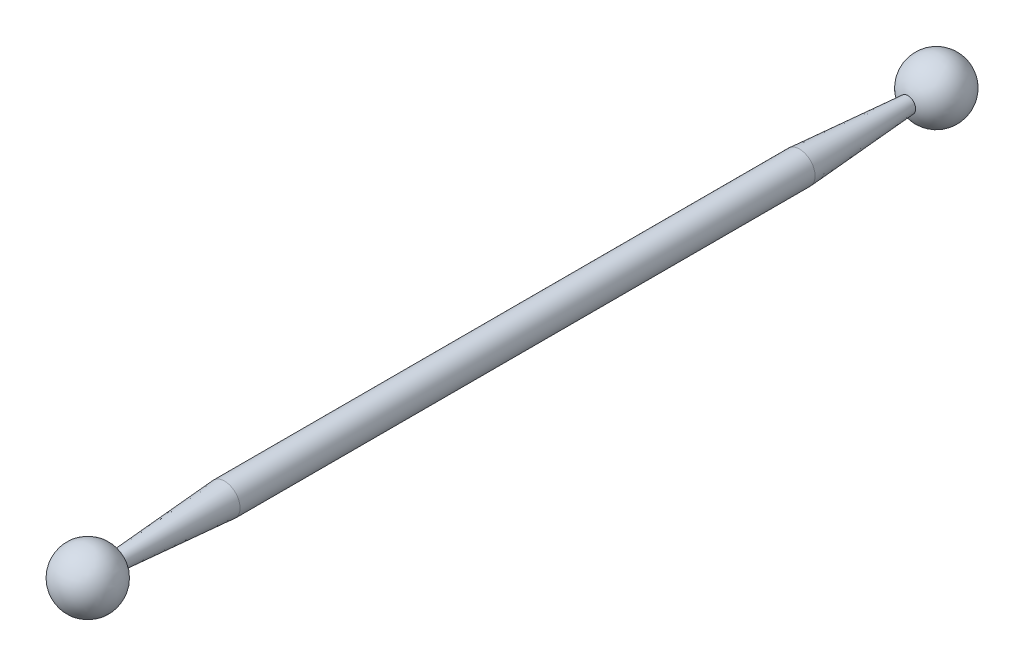
from build123d import *

# Parameters (mm, degrees)
SKETCH2_R           = 5
SKETCH3_R           = 2.5
SKETCH4_R           = 5
BOSS_EXTRUDE2_DEPTH = 185
SKETCH5_R           = 5
SKETCH6_R           = 2.5


with BuildPart() as part:
    # Sketch2 → Loft1 section 0
    with BuildSketch(Plane.XY):
        Circle(SKETCH2_R)
    # Sketch3 → Loft1 section 1
    with BuildSketch(Plane.XY.offset(35)):
        Circle(SKETCH3_R)
    loft()

    # Sketch4 → Boss-Extrude2 (add)
    with BuildSketch(Plane(origin=(0, 0, 0), x_dir=(-1, 0, 0), z_dir=(0, 0, -1))):
        Circle(SKETCH4_R)
    extrude(amount=BOSS_EXTRUDE2_DEPTH)

    # Sketch5 → Loft2 section 0
    with BuildSketch(Plane(origin=(0, 0, -185), x_dir=(-1, 0, 0), z_dir=(0, 0, -1))):
        Circle(SKETCH5_R)
    # Sketch6 → Loft2 section 1
    with BuildSketch(Plane(origin=(0, 0, -220), x_dir=(-1, 0, 0), z_dir=(0, 0, -1))):
        Circle(SKETCH6_R)
    loft()

    # Sketch9 → Revolve2 (revolve)
    with BuildSketch(Plane(origin=(0, 0, -229), x_dir=(-1, 0, 0), z_dir=(0, 0, -1))):
        with BuildLine():
            Line((0, 9.5), (0, -9.5))
            ThreePointArc((0, -9.5), (9.5, 0), (0, 9.5))
        make_face()
    revolve(axis=Axis((0, 9.5, -229), (0, -1, 0)))


with BuildPart() as body_2:
    # Sketch8 → Revolve1 (revolve)
    with BuildSketch(Plane.XY.offset(44)):
        with BuildLine():
            Line((0, 9.5), (0, -9.5))
            ThreePointArc((0, -9.5), (9.5, 0), (0, 9.5))
        make_face()
    revolve(axis=Axis((0, 9.5, 44), (0, -1, 0)))


solid = Compound([part.part, body_2.part])
